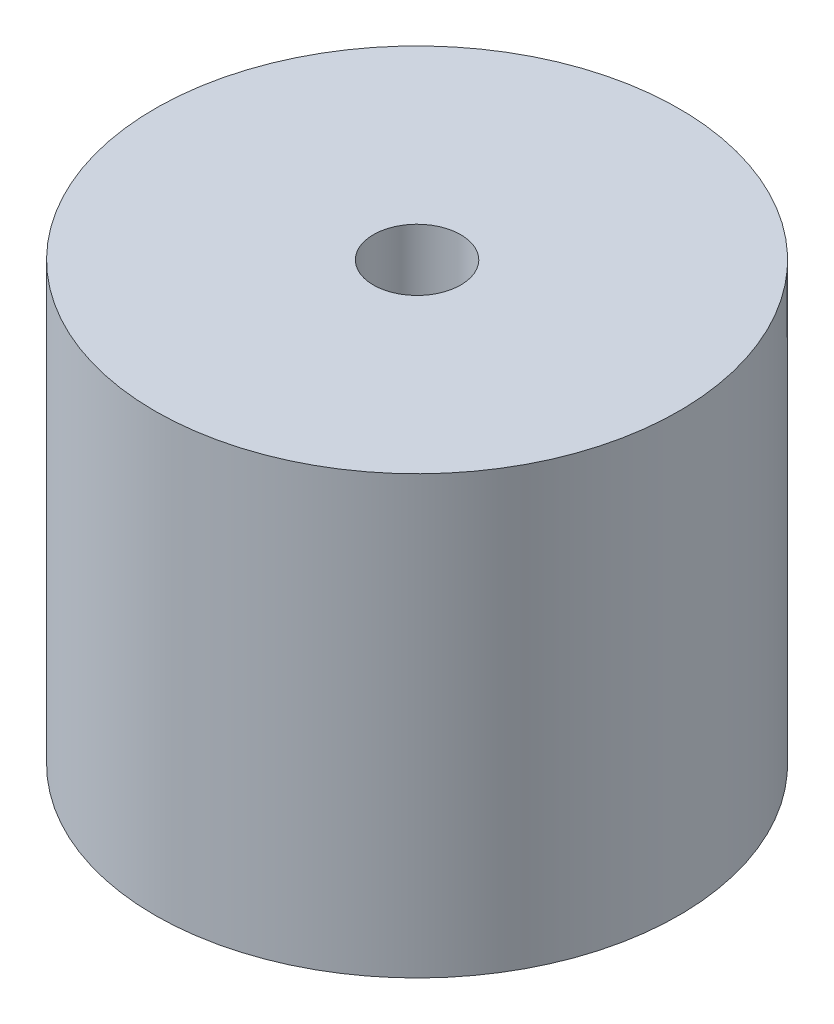
from build123d import *

# Parameters (mm, degrees)
SKETCH1_R           = 18
BOSS_EXTRUDE1_DEPTH = 30
SKETCH2_R           = 3
CUT_EXTRUDE1_DEPTH  = 40.344631146


with BuildPart() as part:
    # Sketch1 → Boss-Extrude1 (new body)
    with BuildSketch(Plane(origin=(0, 0, 0), x_dir=(1, 0, 0), z_dir=(0, 1, 0))):
        with Locations(Location((0, 0, 0), (0, 0, 270))):
            Circle(SKETCH1_R)
    extrude(amount=BOSS_EXTRUDE1_DEPTH)

    # Sketch2 → Cut-Extrude1 (cut, through all)
    with BuildSketch(Plane(origin=(0, 30, 0), x_dir=(1, 0, 0), z_dir=(0, 1, 0))):
        with Locations(Location((0, 0, 0), (0, 0, 270))):
            Circle(SKETCH2_R)
    extrude(amount=-CUT_EXTRUDE1_DEPTH, mode=Mode.SUBTRACT)


solid = part.part
